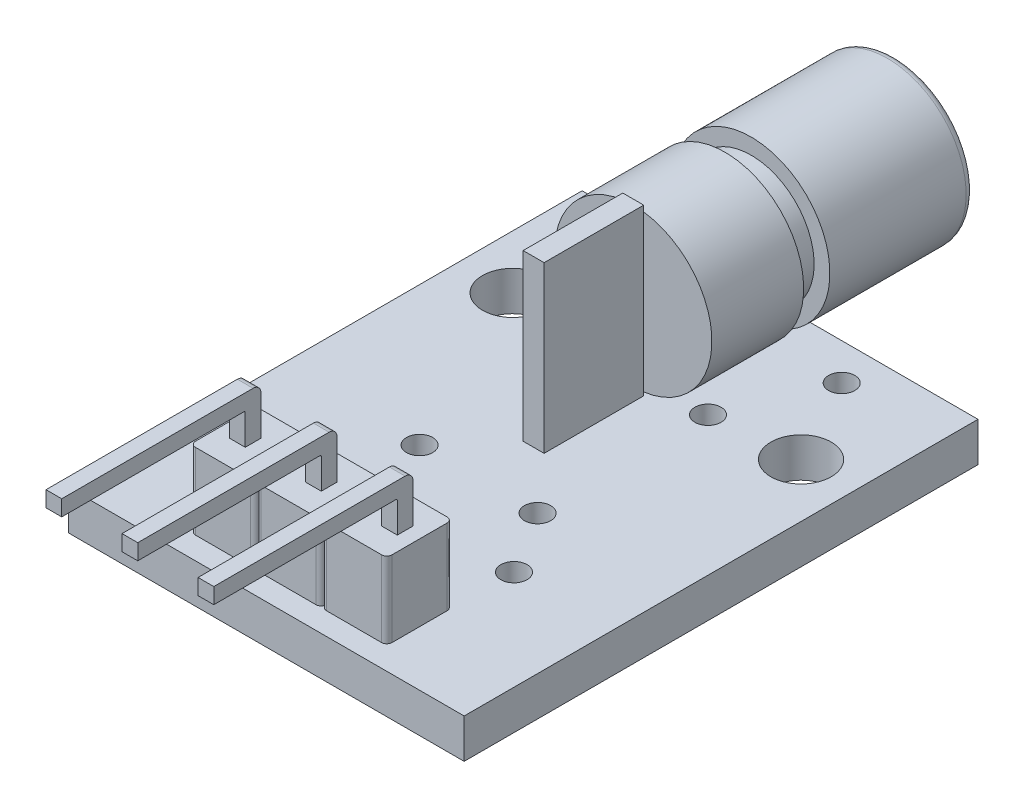
from build123d import *

# Parameters (mm, degrees)
SKETCH1_W           = 15.1
SKETCH1_H           = 19.6
BOSS_EXTRUDE1_DEPTH = 1.5
SKETCH2_W           = 0.6
SKETCH2_H           = 0.6
BOSS_EXTRUDE2_DEPTH = 1.7
BOSS_EXTRUDE3_DEPTH = 2.9
SKETCH4_W           = 0.6
SKETCH4_H           = 0.6
BOSS_EXTRUDE4_DEPTH = 1.8
SKETCH5_W           = 0.6
SKETCH5_H           = 0.6
BOSS_EXTRUDE5_DEPTH = 7
SKETCH7_W           = 0.8
SKETCH7_H           = 3.8
BOSS_EXTRUDE6_DEPTH = 6.3
SKETCH8_R           = 3
BOSS_EXTRUDE7_DEPTH = 3.5
SKETCH9_R           = 2.4
BOSS_EXTRUDE8_DEPTH = 1
SKETCH10_R          = 3
BOSS_EXTRUDE9_DEPTH = 5.5
FILLET1_R           = 0.3
SKETCH11_R          = 1.5
CUT_EXTRUDE1_DEPTH  = 1
SKETCH12_R          = 1.15
CUT_EXTRUDE2_DEPTH  = 18.935788246
CUT_EXTRUDE3_REACH  = 20.516
SKETCH13_R          = 0.5
CUT_EXTRUDE4_REACH  = 20.516
SKETCH14_R          = 0.5
FILLET2_R           = 0.2
FILLET3_R           = 0.05
FILLET5_R           = 0.3


with BuildPart() as part:
    # Sketch1 → Boss-Extrude1 (new body)
    with BuildSketch(Plane(origin=(0, 0, 0), x_dir=(1, 0, 0), z_dir=(0, 1, 0))):
        Rectangle(SKETCH1_W, SKETCH1_H)
    extrude(amount=BOSS_EXTRUDE1_DEPTH)

    # Sketch2 → Boss-Extrude2 (add)
    with BuildSketch(Plane.XZ):
        with Locations((0, 7.7)):
            Rectangle(SKETCH2_W, SKETCH2_H)
        with Locations((2.9, 7.7)):
            Rectangle(SKETCH2_W, SKETCH2_H)
        with Locations((-2.9, 7.7)):
            Rectangle(SKETCH2_W, SKETCH2_H)
    extrude(amount=BOSS_EXTRUDE2_DEPTH)

    # Sketch3 → Boss-Extrude3 (add)
    with BuildSketch(Plane(origin=(0, 1.5, 0), x_dir=(1, 0, 0), z_dir=(0, 1, 0))):
        with BuildLine():
            Line((-3.75, -8.95), (-3.75, -6.45))
            Line((-3.75, -6.45), (-1.45, -6.45))
            ThreePointArc((-1.45, -6.45), (-1.308578644, -6.508578644), (-1.25, -6.65))
            ThreePointArc((-1.25, -6.65), (-1.191421356, -6.508578644), (-1.05, -6.45))
            Line((-1.05, -6.45), (1.05, -6.45))
            ThreePointArc((1.05, -6.45), (1.191421356, -6.508578644), (1.25, -6.65))
            ThreePointArc((1.25, -6.65), (1.308578644, -6.508578644), (1.45, -6.45))
            Line((1.45, -6.45), (3.75, -6.45))
            Line((3.75, -6.45), (3.75, -8.95))
            Line((3.75, -8.95), (1.45, -8.95))
            ThreePointArc((1.45, -8.95), (1.308578644, -8.891421356), (1.25, -8.75))
            ThreePointArc((1.25, -8.75), (1.191421356, -8.891421356), (1.05, -8.95))
            Line((1.05, -8.95), (-1.05, -8.95))
            ThreePointArc((-1.05, -8.95), (-1.191421356, -8.891421356), (-1.25, -8.75))
            ThreePointArc((-1.25, -8.75), (-1.308578644, -8.891421356), (-1.45, -8.95))
            Line((-1.45, -8.95), (-3.75, -8.95))
        make_face()
    extrude(amount=BOSS_EXTRUDE3_DEPTH)

    # Sketch4 → Boss-Extrude4 (add)
    with BuildSketch(Plane(origin=(0, 4.4, 0), x_dir=(1, 0, 0), z_dir=(0, 1, 0))):
        with Locations((-2.9, -7.7)):
            Rectangle(SKETCH4_W, SKETCH4_H)
        with Locations((0, -7.7)):
            Rectangle(SKETCH4_W, SKETCH4_H)
        with Locations((2.9, -7.7)):
            Rectangle(SKETCH4_W, SKETCH4_H)
    extrude(amount=BOSS_EXTRUDE4_DEPTH)

    # Sketch5 → Boss-Extrude5 (add)
    with BuildSketch(Plane.XY.offset(8)):
        with Locations((-2.9, 5.9)):
            Rectangle(SKETCH5_W, SKETCH5_H)
        with Locations((0, 5.9)):
            Rectangle(SKETCH5_W, SKETCH5_H)
        with Locations((2.9, 5.9)):
            Rectangle(SKETCH5_W, SKETCH5_H)
    extrude(amount=BOSS_EXTRUDE5_DEPTH)

    # Sketch7 → Boss-Extrude6 (add)
    with BuildSketch(Plane(origin=(0, 1.5, 0), x_dir=(1, 0, 0), z_dir=(0, 1, 0))):
        with Locations((0, 2.3)):
            Rectangle(SKETCH7_W, SKETCH7_H)
    extrude(amount=BOSS_EXTRUDE6_DEPTH)

    # Sketch8 → Boss-Extrude7 (add)
    with BuildSketch(Plane(origin=(0, 0, -4.2), x_dir=(-1, 0, 0), z_dir=(0, 0, -1))):
        with Locations(Location((0, 4.6, 0), (0, 0, 262.337744339))):
            Circle(SKETCH8_R)
    extrude(amount=BOSS_EXTRUDE7_DEPTH)

    # Sketch9 → Boss-Extrude8 (add)
    with BuildSketch(Plane(origin=(0, 0, -7.7), x_dir=(-1, 0, 0), z_dir=(0, 0, -1))):
        with Locations((0, 4.6)):
            Circle(SKETCH9_R)
    extrude(amount=BOSS_EXTRUDE8_DEPTH)

    # Sketch10 → Boss-Extrude9 (add)
    with BuildSketch(Plane(origin=(0, 0, -8.7), x_dir=(-1, 0, 0), z_dir=(0, 0, -1))):
        with Locations(Location((0, 4.6, 0), (0, 0, 262.337744339))):
            Circle(SKETCH10_R)
    extrude(amount=BOSS_EXTRUDE9_DEPTH)

    # Fillet1
    fillet1_edges = [part.edges().sort_by_distance(p)[0] for p in [
        (-0.4, 7.573213749, -14.2),
    ]]
    fillet(fillet1_edges, radius=FILLET1_R)

    # Sketch11 → Cut-Extrude1 (cut)
    with BuildSketch(Plane(origin=(0, 0, -14.2), x_dir=(-1, 0, 0), z_dir=(0, 0, -1))):
        with Locations((0, 4.6)):
            Circle(SKETCH11_R)
    extrude(amount=-CUT_EXTRUDE1_DEPTH, mode=Mode.SUBTRACT)

    # Sketch12 → Cut-Extrude2 (cut, through all)
    with BuildSketch(Plane(origin=(0, 1.5, 0), x_dir=(1, 0, 0), z_dir=(0, 1, 0))):
        with Locations(Location((-5.5, 5.1, 0), (0, 0, 270))):
            Circle(SKETCH12_R)
        with Locations(Location((5.5, 5.1, 0), (0, 0, 270))):
            Circle(SKETCH12_R)
    extrude(amount=-CUT_EXTRUDE2_DEPTH, mode=Mode.SUBTRACT)

    # Sketch13 → Cut-Extrude3 (cut, up to next)
    with BuildSketch(Plane.XZ, mode=Mode.PRIVATE) as cut_extrude3_sk1:
        with Locations(Location((-2.25, -4.8, 0), (0, 0, 270))):
            Circle(SKETCH13_R)
    cut_extrude3_tool1 = extrude(cut_extrude3_sk1.sketch, amount=-CUT_EXTRUDE3_REACH, mode=Mode.PRIVATE) & part.part
    # Sketch13 → Cut-Extrude3 (cut, up to next)
    with BuildSketch(Plane.XZ, mode=Mode.PRIVATE) as cut_extrude3_sk2:
        with Locations(Location((2.25, -4.8, 0), (0, 0, 270))):
            Circle(SKETCH13_R)
    cut_extrude3_tool2 = extrude(cut_extrude3_sk2.sketch, amount=-CUT_EXTRUDE3_REACH, mode=Mode.PRIVATE) & part.part
    # Sketch13 → Cut-Extrude3 (cut, up to next)
    with BuildSketch(Plane.XZ, mode=Mode.PRIVATE) as cut_extrude3_sk3:
        with Locations(Location((2.25, 1.7, 0), (0, 0, 270))):
            Circle(SKETCH13_R)
    cut_extrude3_tool3 = extrude(cut_extrude3_sk3.sketch, amount=-CUT_EXTRUDE3_REACH, mode=Mode.PRIVATE) & part.part
    # Sketch13 → Cut-Extrude3 (cut, up to next)
    with BuildSketch(Plane.XZ, mode=Mode.PRIVATE) as cut_extrude3_sk4:
        with Locations(Location((-2.25, 1.7, 0), (0, 0, 270))):
            Circle(SKETCH13_R)
    cut_extrude3_tool4 = extrude(cut_extrude3_sk4.sketch, amount=-CUT_EXTRUDE3_REACH, mode=Mode.PRIVATE) & part.part
    add(cut_extrude3_tool1.solids().sort_by_distance((-2.25, 0, -4.8))[0], mode=Mode.SUBTRACT)
    add(cut_extrude3_tool2.solids().sort_by_distance((2.25, 0, -4.8))[0], mode=Mode.SUBTRACT)
    add(cut_extrude3_tool3.solids().sort_by_distance((2.25, 0, 1.7))[0], mode=Mode.SUBTRACT)
    add(cut_extrude3_tool4.solids().sort_by_distance((-2.25, 0, 1.7))[0], mode=Mode.SUBTRACT)

    # Sketch14 → Cut-Extrude4 (cut, up to next)
    with BuildSketch(Plane.XZ, mode=Mode.PRIVATE) as cut_extrude4_sk1:
        with Locations(Location((3.75, 4.1, 0), (0, 0, 270))):
            Circle(SKETCH14_R)
    cut_extrude4_tool1 = extrude(cut_extrude4_sk1.sketch, amount=-CUT_EXTRUDE4_REACH, mode=Mode.PRIVATE) & part.part
    # Sketch14 → Cut-Extrude4 (cut, up to next)
    with BuildSketch(Plane.XZ, mode=Mode.PRIVATE) as cut_extrude4_sk2:
        with Locations(Location((-3.75, 4.1, 0), (0, 0, 270))):
            Circle(SKETCH14_R)
    cut_extrude4_tool2 = extrude(cut_extrude4_sk2.sketch, amount=-CUT_EXTRUDE4_REACH, mode=Mode.PRIVATE) & part.part
    # Sketch14 → Cut-Extrude4 (cut, up to next)
    with BuildSketch(Plane.XZ, mode=Mode.PRIVATE) as cut_extrude4_sk3:
        with Locations(Location((-3.75, -8.4, 0), (0, 0, 270))):
            Circle(SKETCH14_R)
    cut_extrude4_tool3 = extrude(cut_extrude4_sk3.sketch, amount=-CUT_EXTRUDE4_REACH, mode=Mode.PRIVATE) & part.part
    # Sketch14 → Cut-Extrude4 (cut, up to next)
    with BuildSketch(Plane.XZ, mode=Mode.PRIVATE) as cut_extrude4_sk4:
        with Locations(Location((3.75, -8.4, 0), (0, 0, 270))):
            Circle(SKETCH14_R)
    cut_extrude4_tool4 = extrude(cut_extrude4_sk4.sketch, amount=-CUT_EXTRUDE4_REACH, mode=Mode.PRIVATE) & part.part
    add(cut_extrude4_tool1.solids().sort_by_distance((3.75, 0, 4.1))[0], mode=Mode.SUBTRACT)
    add(cut_extrude4_tool2.solids().sort_by_distance((-3.75, 0, 4.1))[0], mode=Mode.SUBTRACT)
    add(cut_extrude4_tool3.solids().sort_by_distance((-3.75, 0, -8.4))[0], mode=Mode.SUBTRACT)
    add(cut_extrude4_tool4.solids().sort_by_distance((3.75, 0, -8.4))[0], mode=Mode.SUBTRACT)

    # Fillet2
    fillet2_edges = [part.edges().sort_by_distance(p)[0] for p in [
        (-3.75, 2.95, 8.95),
        (3.75, 2.95, 8.95),
        (3.75, 2.95, 6.45),
        (-3.75, 2.95, 6.45),
    ]]
    fillet(fillet2_edges, radius=FILLET2_R)

    # Fillet3
    fillet3_edges = [part.edges().sort_by_distance(p)[0] for p in [
        (-2.9, 5.6, 8),
        (0, 5.6, 8),
        (2.9, 5.6, 8),
    ]]
    fillet(fillet3_edges, radius=FILLET3_R)

    # Fillet5
    fillet5_edges = [part.edges().sort_by_distance(p)[0] for p in [
        (0, 6.2, 7.4),
        (2.9, 6.2, 7.4),
        (-2.9, 6.2, 7.4),
    ]]
    fillet(fillet5_edges, radius=FILLET5_R)


solid = part.part
